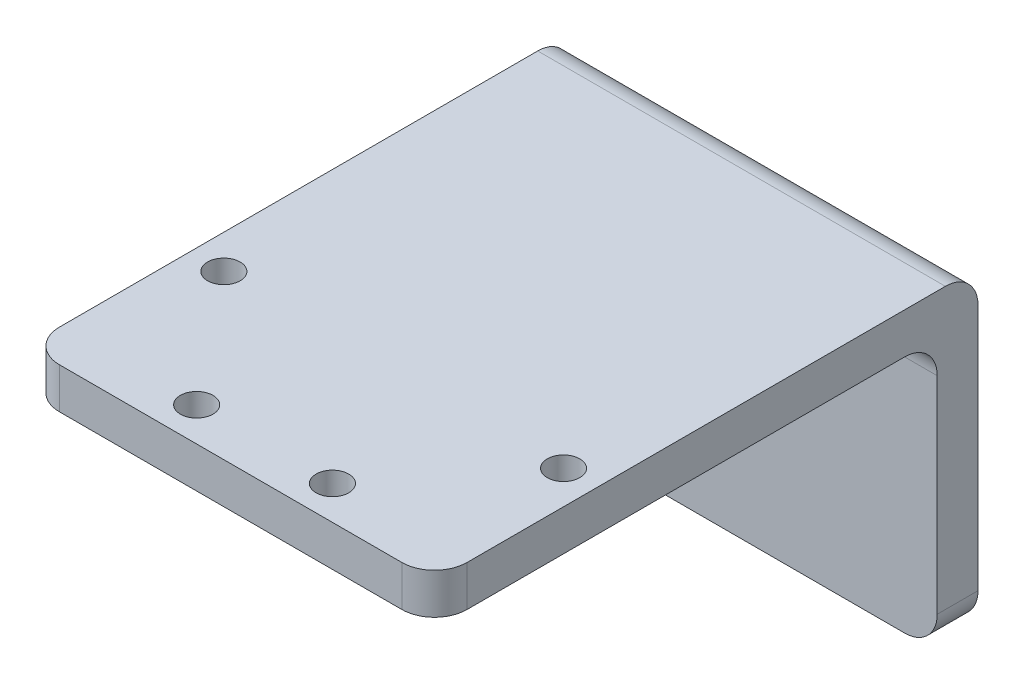
from build123d import *

# Parameters (mm, degrees)
ESBO_O1_W                = 30
ESBO_O1_H                = 40
RESSALTO_EXTRUS_O1_DEPTH = 3
ESBO_O3_R                = 1.2
CORTE_EXTRUS_O2_DEPTH    = 26.179356624
ESBO_O4_W                = 30
ESBO_O4_H                = 3
RESSALTO_EXTRUS_O2_DEPTH = 20
FILETE5_R                = 2.4
FILETE6_R                = 2.4
FILETE7_R                = 2.4
FILETE8_R                = 2.4


with BuildPart() as part:
    # Esboço1 → Ressalto-extrusão1 (new body)
    with BuildSketch(Plane(origin=(0, 0, 0), x_dir=(1, 0, 0), z_dir=(0, 1, 0))):
        Rectangle(ESBO_O1_W, ESBO_O1_H)
    extrude(amount=RESSALTO_EXTRUS_O1_DEPTH)

    # Esboço3 → Corte-extrusão2 (cut, through all)
    with BuildSketch(Plane.XZ):
        with Locations(Location((-5, 17.5, 0), (0, 0, 270))):
            Circle(ESBO_O3_R)
        with Locations(Location((-12.5, 8, 0), (0, 0, 270))):
            Circle(ESBO_O3_R)
        with Locations(Location((12.545132566, 8.047190753, 0), (0, 0, 90))):
            Circle(ESBO_O3_R)
        with Locations(Location((5.009385606, 17.51885997, 0), (0, 0, 90))):
            Circle(ESBO_O3_R)
    extrude(amount=-CORTE_EXTRUS_O2_DEPTH, mode=Mode.SUBTRACT)

    # Esboço4 → Ressalto-extrusão2 (add)
    with BuildSketch(Plane.XZ):
        with Locations((0, -18.5)):
            Rectangle(ESBO_O4_W, ESBO_O4_H)
    extrude(amount=RESSALTO_EXTRUS_O2_DEPTH)

    # Filete5
    filete5_edges = [part.edges().sort_by_distance(p)[0] for p in [
        (0, 0, -17),
    ]]
    fillet(filete5_edges, radius=FILETE5_R)

    # Filete6
    filete6_edges = [part.edges().sort_by_distance(p)[0] for p in [
        (0, 3, -20),
    ]]
    fillet(filete6_edges, radius=FILETE6_R)

    # Filete7
    filete7_edges = [part.edges().sort_by_distance(p)[0] for p in [
        (15, 1.5, 20),
        (-15, 1.5, 20),
    ]]
    fillet(filete7_edges, radius=FILETE7_R)

    # Filete8
    filete8_edges = [part.edges().sort_by_distance(p)[0] for p in [
        (-15, -20, -18.5),
        (15, -20, -18.5),
    ]]
    fillet(filete8_edges, radius=FILETE8_R)


solid = part.part
